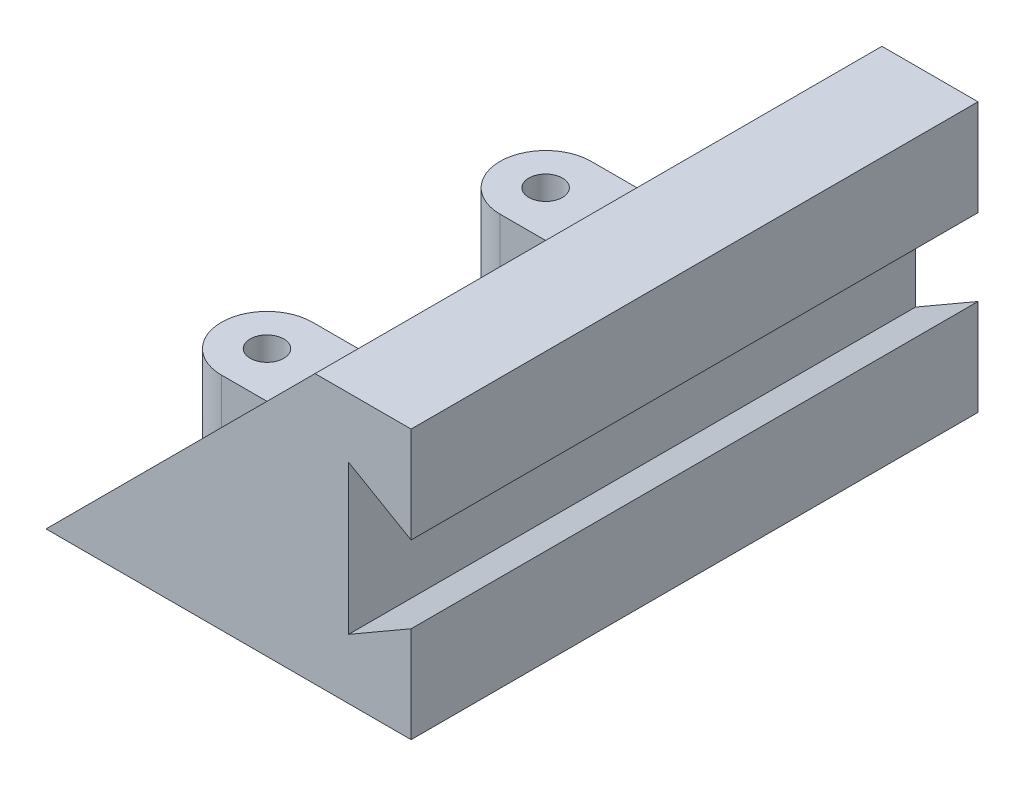
from build123d import *

# Parameters (mm, degrees)
BOSS_EXTRUDE1_DEPTH = 59
BOSS_EXTRUDE6_DEPTH = 12.75
SKETCH3_14_R        = 1.75
CUT_EXTRUDE3_DEPTH  = 12.75


with BuildPart() as part:
    # Sketch1 → Boss-Extrude1 (new body)
    with BuildSketch(Plane.XY):
        Polygon((0, 8), (0, 18), (-10, 18), (-38, -10), (0, -10), (0, 0), (-6.5, -3.75277675), (-6.5, 11.75277675), align=None)
    extrude(amount=BOSS_EXTRUDE1_DEPTH)

    # Sketch3 → Boss-Extrude6 (add)
    with BuildSketch(Plane.XZ.offset(10)):
        with BuildLine():
            Line((-25.25, 48.75), (-25.25, 39.25))
            Line((-25.25, 39.25), (-30, 39.25))
            ThreePointArc((-30, 39.25), (-34.75, 44), (-30, 48.75))
            Line((-30, 48.75), (-25.25, 48.75))
        make_face()
    boss_extrude6 = extrude(amount=-BOSS_EXTRUDE6_DEPTH)

    # Sketch3<14> → Cut-Extrude3 (cut)
    with BuildSketch(Plane.XZ.offset(10)):
        with Locations((-30, 44)):
            Circle(SKETCH3_14_R)
    cut_extrude3 = extrude(amount=-CUT_EXTRUDE3_DEPTH, mode=Mode.SUBTRACT)

    # Mirror1: Boss-Extrude6, Cut-Extrude3 across plane
    add(boss_extrude6.mirror(Plane.XY.offset(29.5)))
    add(cut_extrude3.mirror(Plane.XY.offset(29.5)), mode=Mode.SUBTRACT)


solid = part.part
